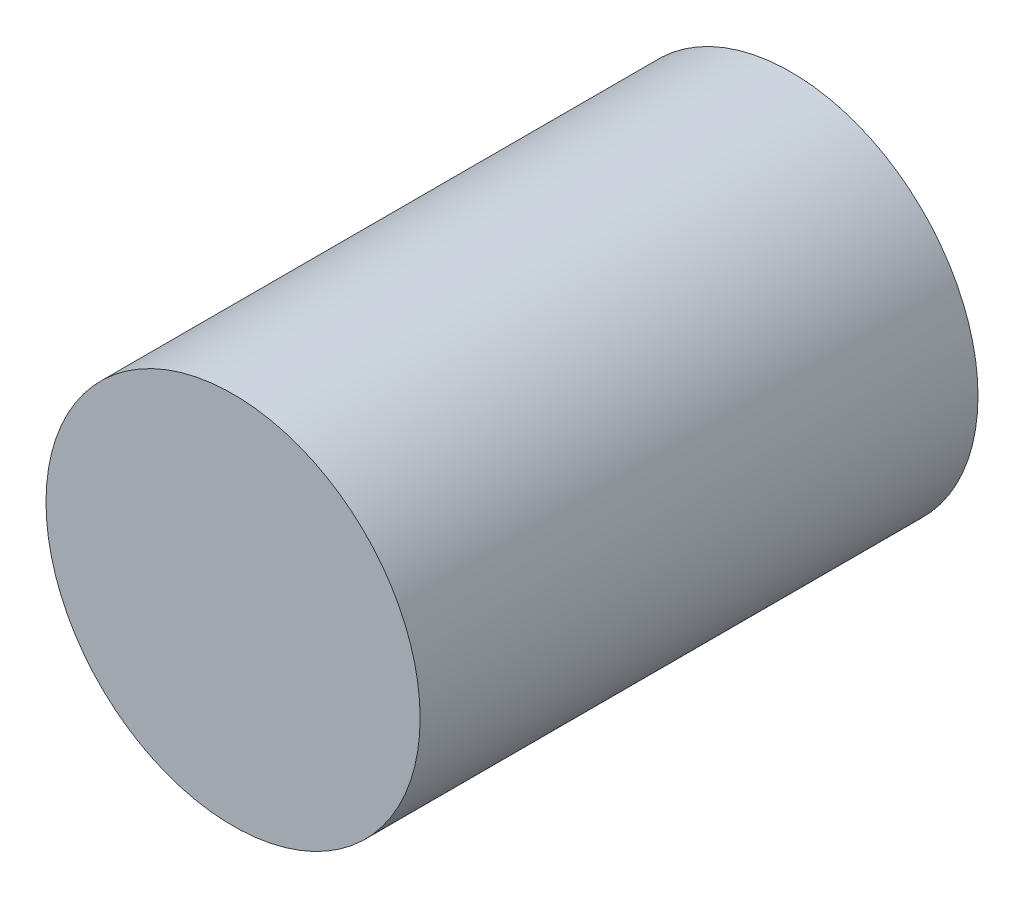
from build123d import *

# Parameters (mm, degrees)
SKETCH1_R           = 18.375
BOSS_EXTRUDE1_DEPTH = 54.8


with BuildPart() as part:
    # Sketch1 → Boss-Extrude1 (new body)
    with BuildSketch(Plane.XY):
        with Locations(Location((0, 0, 0), (0, 0, 180))):
            Circle(SKETCH1_R)
    extrude(amount=BOSS_EXTRUDE1_DEPTH)


solid = part.part
